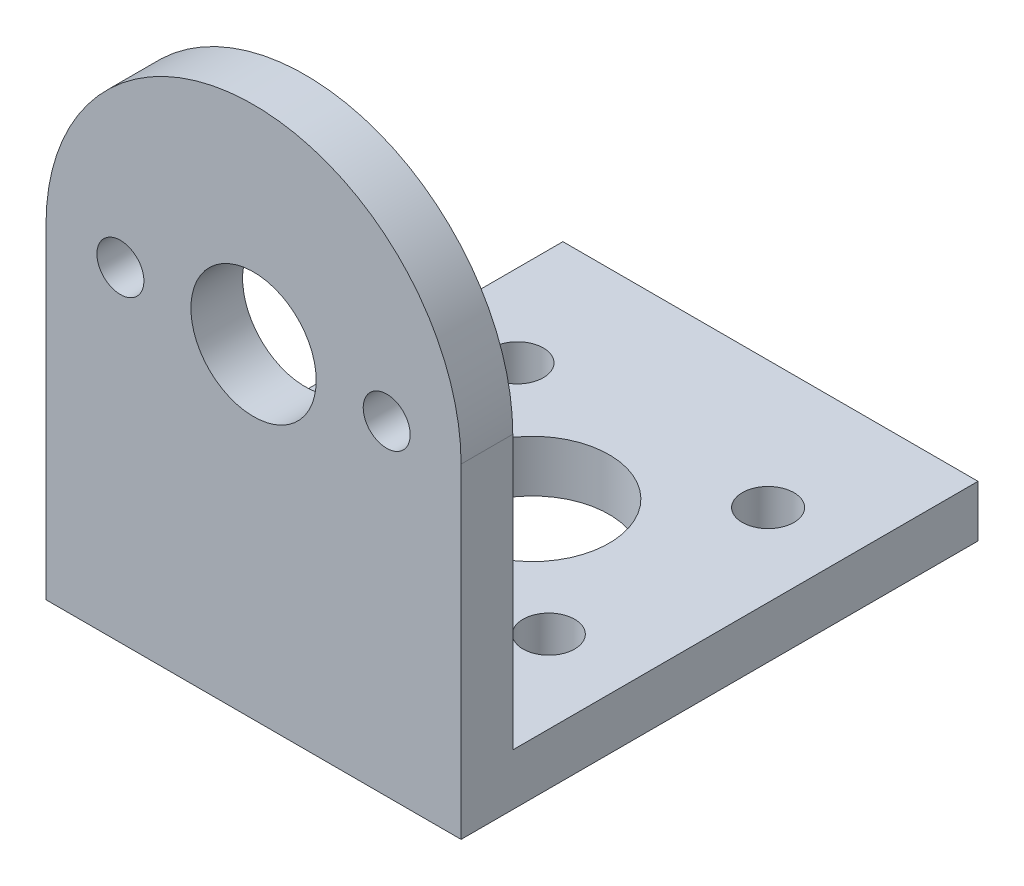
from build123d import *

# Parameters (mm, degrees)
SKETCH_1_R          = 4
SKETCH_1_R_2        = 1.5
EXTRUDE_1_DEPTH     = 3.3
SKETCH_2_W          = 26.5
SKETCH_2_H          = 3.3
EXTRUDE_2_DEPTH     = 29.7
SKETCH_3_R          = 4.9
SKETCH_3_R_2        = 1.65
CUT_EXTRUDE_1_DEPTH = 3.3


with BuildPart() as part:
    # 草图1 → 凸台-拉伸1 (new body)
    with BuildSketch(Plane.XY):
        with BuildLine():
            Line((-13.25, 0), (-13.25, -20.75))
            Line((-13.25, -20.75), (13.25, -20.75))
            Line((13.25, -20.75), (13.25, 0))
            ThreePointArc((13.25, 0), (0, 13.25), (-13.25, 0))
        make_face()
        Circle(SKETCH_1_R, mode=Mode.SUBTRACT)
        with Locations((-8.5, 0)):
            Circle(SKETCH_1_R_2, mode=Mode.SUBTRACT)
        with Locations(Location((8.5, 0, 0), (0, 0, 180))):
            Circle(SKETCH_1_R_2, mode=Mode.SUBTRACT)
    extrude(amount=EXTRUDE_1_DEPTH)

    # 草图2 → 凸台-拉伸2 (add)
    with BuildSketch(Plane.XY):
        with Locations((0, -19.1)):
            Rectangle(SKETCH_2_W, SKETCH_2_H)
    extrude(amount=-EXTRUDE_2_DEPTH)

    # 草图3 → 切除-拉伸1 (cut)
    with BuildSketch(Plane(origin=(0, -17.45, 0), x_dir=(1, 0, 0), z_dir=(0, 1, 0))):
        with Locations(Location((0, 14.5, 0), (0, 0, 180))):
            Circle(SKETCH_3_R)
        with Locations(Location((-8, 21.55, 0), (0, 0, 180))):
            Circle(SKETCH_3_R_2)
        with Locations(Location((-8, 7.55, 0), (0, 0, 180))):
            Circle(SKETCH_3_R_2)
        with Locations(Location((8, 7.55, 0), (0, 0, 270))):
            Circle(SKETCH_3_R_2)
        with Locations(Location((8, 21.55, 0), (0, 0, 270))):
            Circle(SKETCH_3_R_2)
    extrude(amount=-CUT_EXTRUDE_1_DEPTH, mode=Mode.SUBTRACT)


solid = part.part
